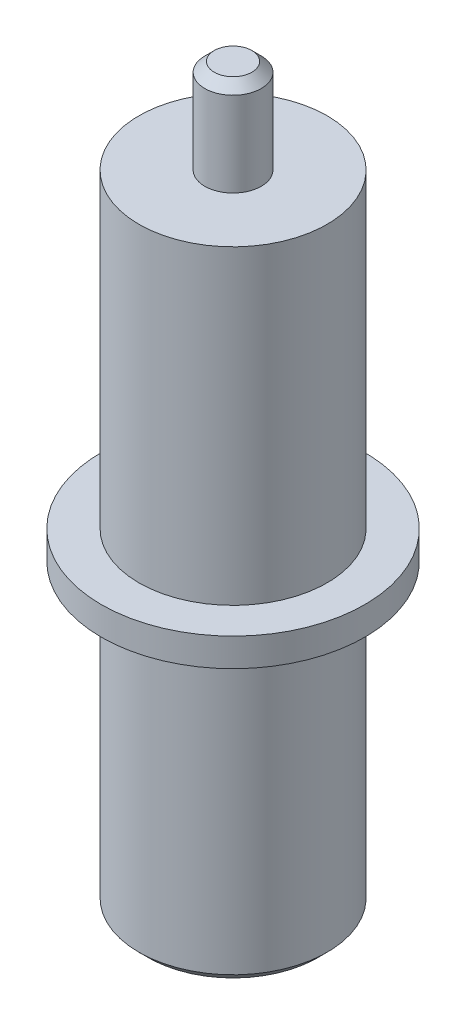
from build123d import *

# Parameters (mm, degrees)
CHAMFER_1_SIZE = 0.5


with BuildPart() as part:
    # Эскиз1 → Повернуть1 (revolve)
    with BuildSketch(Plane.XY, mode=Mode.PRIVATE) as revolve_1_sk:
        Polygon((-7, 16), (-7, 17.5), (-5, 17.5), (-5, 34), (-1.5, 34), (-1.5, 39), (0, 39), (0, 0), (-5, 0), (-5, 16), align=None)
    revolve(revolve_1_sk.sketch.rotate(Axis((0, 16.714668184, 0), (0, -1, 0)), 270), axis=Axis((0, 16.714668184, 0), (0, -1, 0)))

    # Фаска1
    chamfer_1_edges = [part.edges().sort_by_distance(p)[0] for p in [
        (0, 0, -5),
        (0, 39, -1.5),
    ]]
    chamfer(chamfer_1_edges, length=CHAMFER_1_SIZE)


solid = part.part
